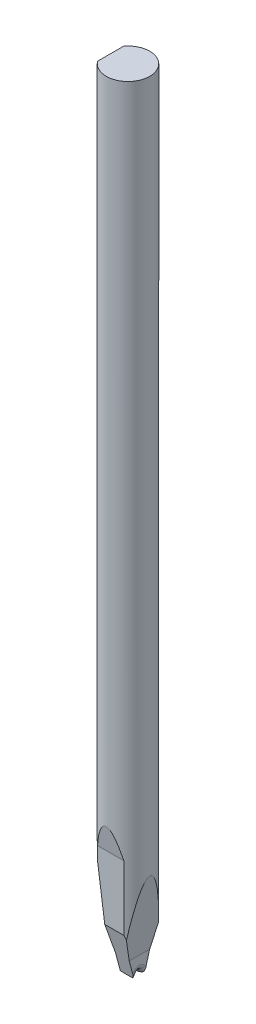
from build123d import *

# Parameters (mm, degrees)
SKETCH_TL_CUTTING_R    = 1.99771
TL_CUTTING_DEPTH       = 71.99884
SKETCH_TDF_CUTTING_W   = 4.01541996
SKETCH_TDF_CUTTING_H   = 4.01541996
TDF_CUTTING_DEPTH      = 73.054247979
VW_VR_GRINDING_DEPTH   = 2.00770998
VW_VR_GRINDING_2_DEPTH = 2.00770998
ISA_GRINDING_DEPTH     = 2.00770998
SKETCH_PRE_FRX_BRX_W   = 0.93996002
SKETCH_PRE_FRX_BRX_H   = 1.6256
SKETCH_PRE_FRX_BRX_W_2 = 1.81577996
PRE_FRX_BRX_DEPTH      = 2.00770998
FA_BA_GRINDING_DEPTH   = 2.00770998
BR_EDM_R               = 0.24892
FR_EDM_R               = 0.50038


with BuildPart() as part:
    # sketch_TL_cutting → TL_cutting (new body)
    with BuildSketch(Plane(origin=(0, 0, 0), x_dir=(1, 0, 0), z_dir=(0, 1, 0))):
        with Locations(Location((0, 0, 0), (0, 0, 270))):
            Circle(SKETCH_TL_CUTTING_R)
    extrude(amount=TL_CUTTING_DEPTH)

    # sketch_TDF_cutting → TDF_cutting (cut, through all)
    with BuildSketch(Plane(origin=(0, 0, 0), x_dir=(1, 0, 0), z_dir=(0, 1, 0))):
        with Locations((-3.60917998, 0)):
            Rectangle(SKETCH_TDF_CUTTING_W, SKETCH_TDF_CUTTING_H)
    extrude(amount=TDF_CUTTING_DEPTH, mode=Mode.SUBTRACT)


with BuildPart() as body_2:
    # sketch_VW_VR_grinding → VW_VR_grinding (new, symmetric)
    with BuildSketch(Plane(origin=(0, 0, 0), x_dir=(0, 0, -1), z_dir=(1, 0, 0))):
        with BuildLine():
            Line((-1.59004, -0.00999998), (-1.59004, 9.985377879))
            ThreePointArc((-1.59004, 9.985377879), (-1.591006547, 10.007515438), (-1.593898831, 10.029484517))
            Line((-1.593898831, 10.029484517), (-2.01770996, 12.433036869))
            Line((-2.01770996, 12.433036869), (-2.00770998, -0.00999998))
            Line((-2.00770998, -0.00999998), (-1.59004, -0.00999998))
        make_face()
    extrude(amount=VW_VR_GRINDING_DEPTH, both=True)


with BuildPart() as body_3:
    # sketch_VW_VR_grinding → VW_VR_grinding 2 (new, symmetric)
    with BuildSketch(Plane(origin=(0, 0, 0), x_dir=(0, 0, -1), z_dir=(1, 0, 0))):
        with BuildLine():
            Line((1.59004, -0.00999998), (1.59004, 9.985377879))
            ThreePointArc((1.59004, 9.985377879), (1.591006547, 10.007515438), (1.593898831, 10.029484517))
            Line((1.593898831, 10.029484517), (2.01770996, 12.433036869))
            Line((2.01770996, 12.433036869), (2.00770998, -0.00999998))
            Line((2.00770998, -0.00999998), (1.59004, -0.00999998))
        make_face()
    extrude(amount=VW_VR_GRINDING_2_DEPTH, both=True)


    add(body_2.part)  # ISA_grinding merges body 2
    # sketch_ISA_grinding → ISA_grinding (add, symmetric)
    with BuildSketch(Plane(origin=(0, 0, 0), x_dir=(0, 0, -1), z_dir=(1, 0, 0))):
        Polygon((-0.50038, 0), (0.50038, 0), (2.00770998, 5.625432069), (2.00770998, -0.02999994), (-2.00770998, -0.02999994), (-2.00770998, 5.625432069), align=None)
    extrude(amount=ISA_GRINDING_DEPTH, both=True)

    # sketch_pre_FRX_BRX → pre_FRX_BRX (add, symmetric)
    with BuildSketch(Plane.XY):
        with Locations((1.52772999, 0.80280002)):
            Rectangle(SKETCH_PRE_FRX_BRX_W, SKETCH_PRE_FRX_BRX_H)
        with Locations((-1.10981998, 0.80280002)):
            Rectangle(SKETCH_PRE_FRX_BRX_W_2, SKETCH_PRE_FRX_BRX_H)
    extrude(amount=PRE_FRX_BRX_DEPTH, both=True)

    # sketch_FA_BA_grinding → FA_BA_grinding (add, symmetric)
    with BuildSketch(Plane.XY):
        Polygon((1.04775, -0.00999998), (1.04775, 1.6256), (2.12471, 9.288568576), (2.12471, -0.00999998), align=None)
        Polygon((-0.20193, -0.00999998), (-0.20193, 1.6256), (-1.72847, 12.487496496), (-1.72847, -0.00999998), align=None)
    extrude(amount=FA_BA_GRINDING_DEPTH, both=True)


with BuildPart() as part_1:
    add(part.part)

    # B1_fix: cut body 3
    add(body_3.part, mode=Mode.SUBTRACT)

    # V-Groove_EDM: sweep along a path in sketch_contour_V-Groove
    with BuildLine(Plane.XY) as v_groove_edm_path:
        Line((-1.60147, 0.32004), (1.99771, 0.32004))
    # sketch_section_V-Groove → V-Groove_EDM (sweep, cut)
    with BuildSketch(Plane(origin=(-1.60147, 0, -1.2954), x_dir=(0, 0, -1), z_dir=(1, 0, 0))):
        with BuildLine():
            Line((-1.216335445, 0.278881598), (-1.014058386, -0.00999998))
            Line((-1.014058386, -0.00999998), (-1.576741614, -0.00999998))
            Line((-1.576741614, -0.00999998), (-1.374464555, 0.278881598))
            ThreePointArc((-1.374464555, 0.278881598), (-1.2954, 0.32004), (-1.216335445, 0.278881598))
        make_face()
    sweep(path=v_groove_edm_path.line, mode=Mode.SUBTRACT)

    # BR_EDM
    br_edm_edges = [part_1.edges().sort_by_distance(p)[0] for p in [
        (-0.20193, 0.32004, 0),
        (-0.20193, 0.139440799, -0.176702054),
        (-0.20193, 0.139440799, 0.176702054),
    ]]
    fillet(br_edm_edges, radius=BR_EDM_R)

    # FR_EDM
    fr_edm_edges = [part_1.edges().sort_by_distance(p)[0] for p in [
        (1.04775, 0.139440799, -0.176702054),
        (1.04775, 0.139440799, 0.176702054),
        (1.04775, 0.32004, 0),
    ]]
    fillet(fr_edm_edges, radius=FR_EDM_R)


solid = part_1.part
